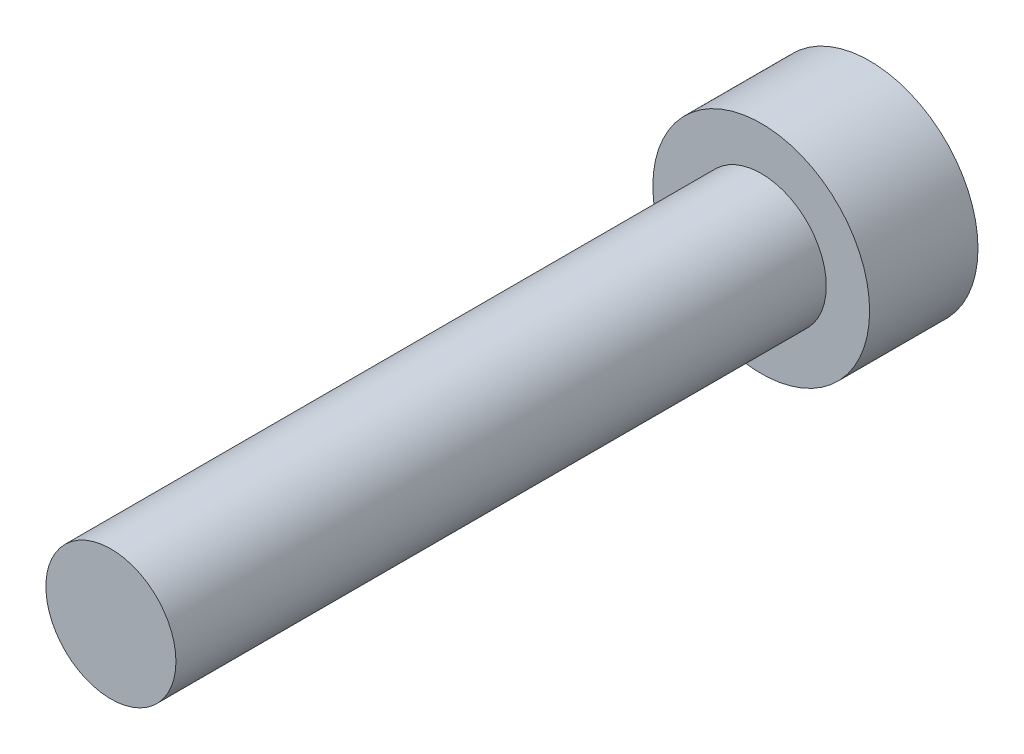
from build123d import *

# Parameters (mm, degrees)
SKETCH1_R           = 2.5
BOSS_EXTRUDE3_DEPTH = 2.5
SKETCH1_3_R         = 1.5
BOSS_EXTRUDE4_DEPTH = 15


with BuildPart() as part:
    # Sketch1 → Boss-Extrude3 (new body)
    with BuildSketch(Plane.XY):
        Circle(SKETCH1_R)
    extrude(amount=-BOSS_EXTRUDE3_DEPTH)

    # Sketch1<3> → Boss-Extrude4 (add)
    with BuildSketch(Plane.XY):
        Circle(SKETCH1_3_R)
    extrude(amount=BOSS_EXTRUDE4_DEPTH)


solid = part.part
